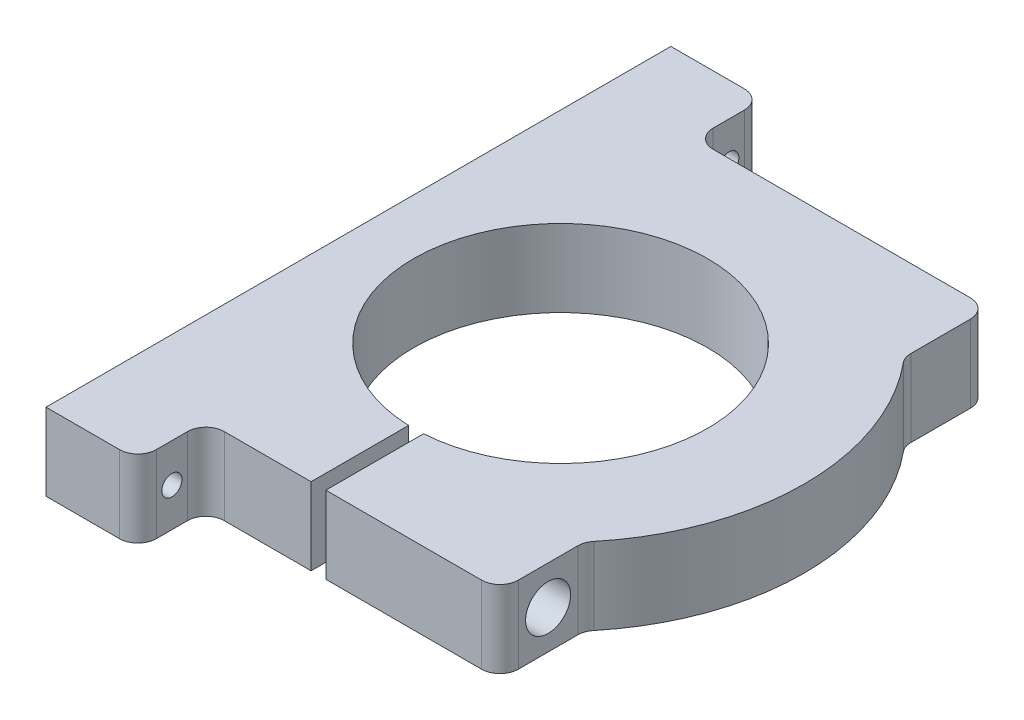
from build123d import *

# Parameters (mm, degrees)
BOSS_EXTRUDE2_DEPTH                     = 21
FILLET2_R                               = 5
M5_CLEARANCE_HOLE1_D                    = 5.5
CBORE_FOR_M5_HEX_HEAD_BOLT1_D           = 5.5
CBORE_FOR_M5_HEX_HEAD_BOLT1_DEPTH       = 47.375
CBORE_FOR_M5_HEX_HEAD_BOLT1_CBORE_D     = 12.238
CBORE_FOR_M5_HEX_HEAD_BOLT1_CBORE_DEPTH = 23.5
TAP_DRILL_FOR_M5_TAP1_D                 = 4.2


with BuildPart() as part:
    # Sketch1 → Boss-Extrude2 (new body)
    with BuildSketch(Plane(origin=(0, 0, -219.72), x_dir=(1, 0, 0), z_dir=(0, -1, 0))):
        with BuildLine():
            Line((17.325408024, -30.717863594), (-30.049591976, -30.717863594))
            Line((-30.049591976, -30.717863594), (-30.049591976, -57.304089343))
            ThreePointArc((-30.049591976, -57.304089343), (-33.300374886, -137.212968242), (-34.049591976, -57.241503392))
            Line((-34.049591976, -57.241503392), (-34.049591976, -30.717863594))
            Line((-34.049591976, -30.717863594), (-62.674591976, -30.717863594))
            Line((-62.674591976, -30.717863594), (-62.674591976, -12.217863594))
            Line((-62.674591976, -12.217863594), (-87.674591976, -12.217863594))
            Line((-87.674591976, -12.217863594), (-87.674591976, -182.217863594))
            Line((-87.674591976, -182.217863594), (-62.674591976, -182.217863594))
            Line((-62.674591976, -182.217863594), (-62.674591976, -163.717863594))
            Line((-62.674591976, -163.717863594), (17.325408024, -163.717863594))
            Line((17.325408024, -163.717863594), (17.325408024, -140.681210221))
            ThreePointArc((17.325408024, -140.681210221), (33.575408024, -97.217863594), (17.325408024, -53.754516967))
            Line((17.325408024, -53.754516967), (17.325408024, -30.717863594))
        make_face()
    extrude(amount=BOSS_EXTRUDE2_DEPTH)

    # Fillet2
    fillet2_edges = [part.edges().sort_by_distance(p)[0] for p in [
        (-62.674591976, -10.5, -250.437863594),
        (-62.674591976, -10.5, -231.937863594),
        (-62.674591976, -10.5, -401.937863594),
        (-62.674591976, -10.5, -383.437863594),
        (17.325408024, -10.5, -383.437863594),
        (17.325408024, -10.5, -360.401210221),
        (17.325408024, -10.5, -273.474516967),
        (17.325408024, -10.5, -250.437863594),
    ]]
    fillet(fillet2_edges, radius=FILLET2_R)

    # M5 Clearance Hole1 (through all)
    with Locations(Plane(origin=(17.325408024, 0, 0), x_dir=(0, 0, -1), z_dir=(1, 0, 0))):
        with Locations((392.687863594, -10.5), (241.187863594, -10.5)):
            Hole(M5_CLEARANCE_HOLE1_D / 2)

    # CBORE for M5 Hex Head Bolt1
    with Locations(Plane(origin=(17.325408024, 0, 0), x_dir=(0, 0, -1), z_dir=(1, 0, 0))):
        with Locations((263.540774929, -10.5)):
            CounterBoreHole(CBORE_FOR_M5_HEX_HEAD_BOLT1_D / 2, CBORE_FOR_M5_HEX_HEAD_BOLT1_CBORE_D / 2, CBORE_FOR_M5_HEX_HEAD_BOLT1_CBORE_DEPTH, depth=CBORE_FOR_M5_HEX_HEAD_BOLT1_DEPTH)

    # Tap Drill for M5 Tap1 (through all)
    with Locations(Plane(origin=(-34.049591976, 0, 0), x_dir=(0, 0, -1), z_dir=(1, 0, 0))):
        with Locations((263.540774929, -10.5)):
            Hole(TAP_DRILL_FOR_M5_TAP1_D / 2)


solid = part.part
